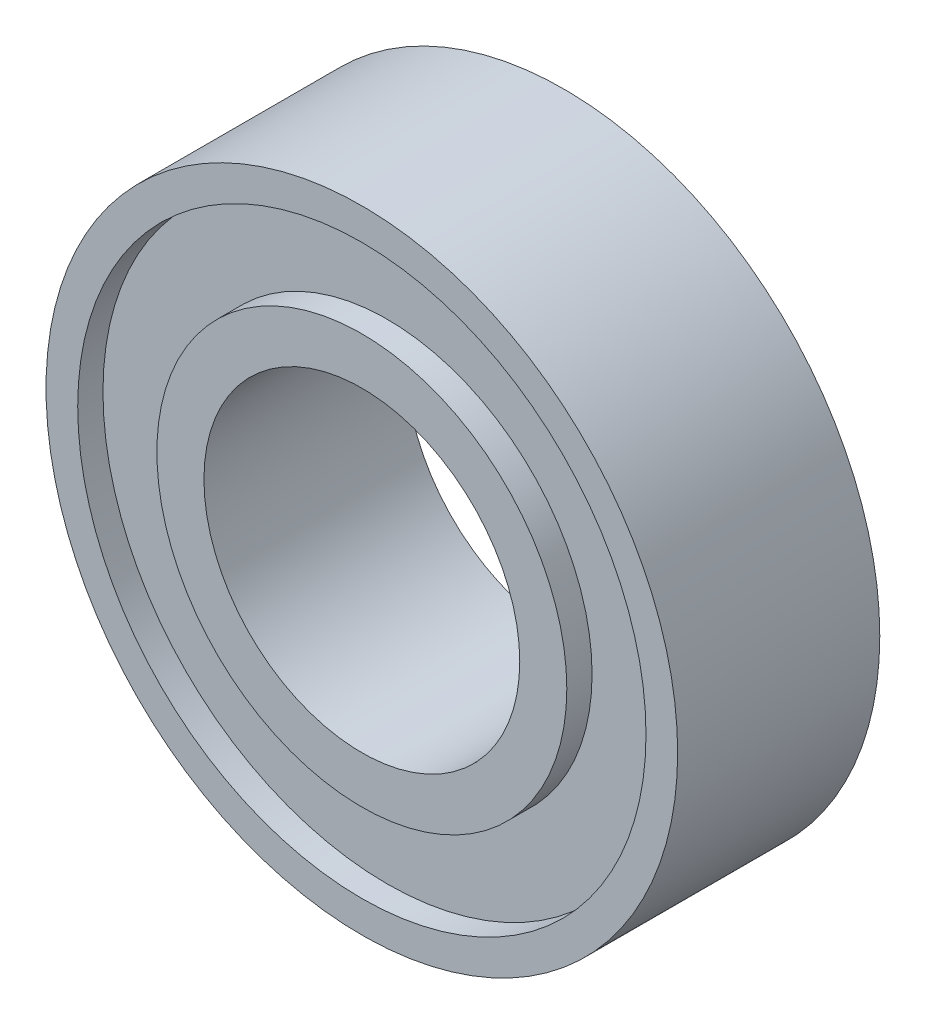
from build123d import *

# Parameters (mm, degrees)
SKETCH1_R           = 12.5
SKETCH1_R_2         = 6.25
BOSS_EXTRUDE1_DEPTH = 8
SKETCH2_R           = 11.246403069
SKETCH2_R_2         = 8.112482208
CUT_EXTRUDE1_DEPTH  = 1


with BuildPart() as part:
    # Sketch1 → Boss-Extrude1 (new body)
    with BuildSketch(Plane.XY):
        Circle(SKETCH1_R)
        Circle(SKETCH1_R_2, mode=Mode.SUBTRACT)
    extrude(amount=BOSS_EXTRUDE1_DEPTH)

    # Sketch2 → Cut-Extrude1 (cut)
    with BuildSketch(Plane.XY.offset(8)):
        Circle(SKETCH2_R)
        Circle(SKETCH2_R_2, mode=Mode.SUBTRACT)
    cut_extrude1 = extrude(amount=-CUT_EXTRUDE1_DEPTH, mode=Mode.SUBTRACT)

    # Mirror1: Cut-Extrude1 across plane
    add(cut_extrude1.mirror(Plane.XY.offset(4)), mode=Mode.SUBTRACT)


solid = part.part
